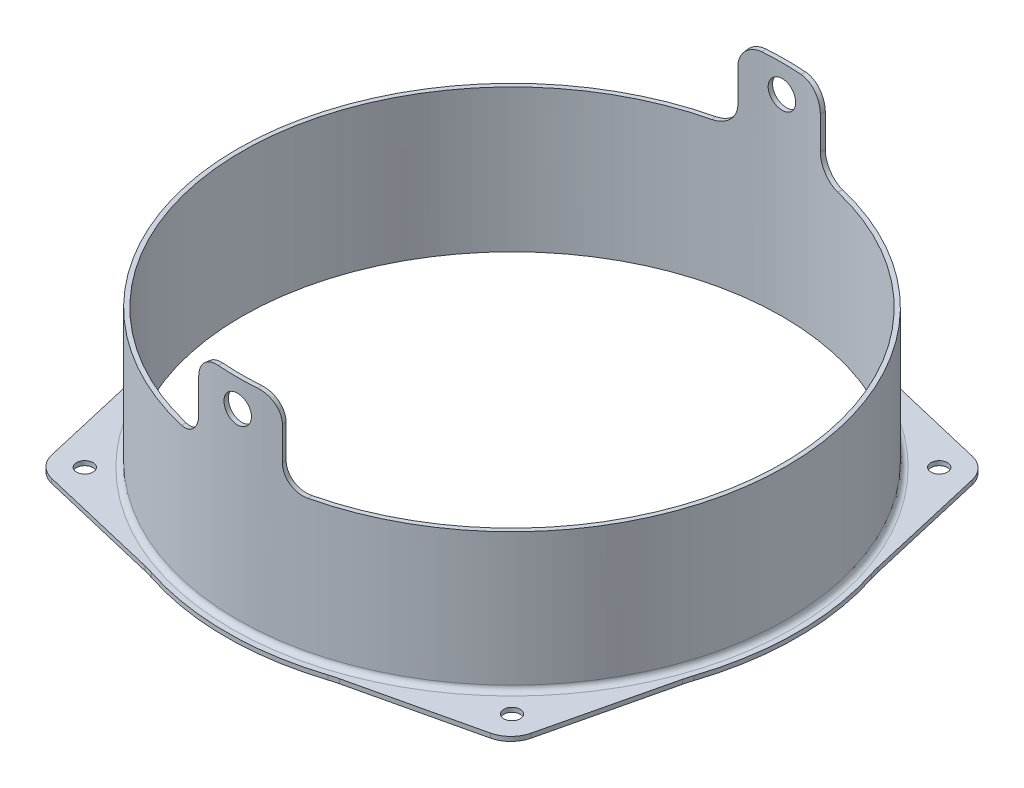
from build123d import *

# Parameters (mm, degrees)
SKETCH1_R               = 50
SKETCH1_R_2             = 1.5
BOSS_EXTRUDE1_DEPTH     = 0.8
SKETCH1_4_R             = 50
SKETCH1_4_R_2           = 49.2
BOSS_EXTRUDE3_DEPTH     = 40
FILLET1_R               = 1
CUT_EXTRUDE1_START      = -14
CUT_EXTRUDE1_DEPTH      = 14
CUT_EXTRUDE2_START      = -14
CUT_EXTRUDE2_DEPTH      = 14
FILLET2_R               = 4
FILLET4_R               = 4
CUT_EXTRUDE3_DEPTH      = 84.713798194
CUT_EXTRUDE3_DEPTH_BACK = 84.713798194
SKETCH16_R              = 2.5


with BuildPart() as part:
    # Sketch1 → Boss-Extrude1 (new body)
    with BuildSketch(Plane(origin=(0, 0, 0), x_dir=(1, 0, 0), z_dir=(0, 1, 0))):
        with BuildLine():
            Line((17.897079586, 48.929734976), (40.149284407, 43.651218265))
            ThreePointArc((40.149284407, 43.651218265), (42.540265174, 42.312242187), (43.866371506, 39.91409958))
            Line((43.866371506, 39.91409958), (49.02521675, 17.633846579))
            ThreePointArc((49.02521675, 17.633846579), (49.23478351, 16.809026698), (49.479249782, 15.993868858))
            ThreePointArc((49.479249782, 15.993868858), (51.999812242, -0.139738387), (49.392575566, -16.259565766))
            ThreePointArc((49.392575566, -16.259565766), (49.143731732, -17.073397941), (48.929734976, -17.897079586))
            Line((48.929734976, -17.897079586), (43.651218265, -40.149284407))
            ThreePointArc((43.651218265, -40.149284407), (42.312242187, -42.540265174), (39.91409958, -43.866371506))
            Line((39.91409958, -43.866371506), (17.633846579, -49.02521675))
            ThreePointArc((17.633846579, -49.02521675), (16.809026698, -49.23478351), (15.993868858, -49.479249782))
            ThreePointArc((15.993868858, -49.479249782), (-0.139738387, -51.999812242), (-16.259565766, -49.392575566))
            ThreePointArc((-16.259565766, -49.392575566), (-17.073397941, -49.143731732), (-17.897079586, -48.929734976))
            Line((-17.897079586, -48.929734976), (-40.149284407, -43.651218265))
            ThreePointArc((-40.149284407, -43.651218265), (-42.540265174, -42.312242187), (-43.866371506, -39.91409958))
            Line((-43.866371506, -39.91409958), (-49.02521675, -17.633846579))
            ThreePointArc((-49.02521675, -17.633846579), (-49.23478351, -16.809026698), (-49.479249782, -15.993868858))
            ThreePointArc((-49.479249782, -15.993868858), (-51.999812242, 0.139738387), (-49.392575566, 16.259565766))
            ThreePointArc((-49.392575566, 16.259565766), (-49.143731732, 17.073397941), (-48.929734976, 17.897079586))
            Line((-48.929734976, 17.897079586), (-43.651218265, 40.149284407))
            ThreePointArc((-43.651218265, 40.149284407), (-42.312242187, 42.540265174), (-39.91409958, 43.866371506))
            Line((-39.91409958, 43.866371506), (-17.633846579, 49.02521675))
            ThreePointArc((-17.633846579, 49.02521675), (-16.809026698, 49.23478351), (-15.993868858, 49.479249782))
            ThreePointArc((-15.993868858, 49.479249782), (-8.026622704, 51.3767781), (0.139738387, 51.999812242))
            ThreePointArc((0.139738387, 51.999812242), (8.302633013, 51.332896714), (16.259565766, 49.392575566))
            ThreePointArc((16.259565766, 49.392575566), (17.073397941, 49.143731732), (17.897079586, 48.929734976))
        make_face()
        Circle(SKETCH1_R, mode=Mode.SUBTRACT)
        with Locations((-38.8907, 38.8907)):
            Circle(SKETCH1_R_2, mode=Mode.SUBTRACT)
        with Locations((38.8907, 38.8907)):
            Circle(SKETCH1_R_2, mode=Mode.SUBTRACT)
        with Locations((38.8907, -38.8907)):
            Circle(SKETCH1_R_2, mode=Mode.SUBTRACT)
        with Locations((-38.8907, -38.8907)):
            Circle(SKETCH1_R_2, mode=Mode.SUBTRACT)
    extrude(amount=BOSS_EXTRUDE1_DEPTH)

    # Sketch1<4> → Boss-Extrude3 (add)
    with BuildSketch(Plane(origin=(0, 0, 0), x_dir=(1, 0, 0), z_dir=(0, 1, 0))):
        Circle(SKETCH1_4_R)
        Circle(SKETCH1_4_R_2, mode=Mode.SUBTRACT)
    extrude(amount=BOSS_EXTRUDE3_DEPTH)

    # Fillet1
    fillet1_edges = [part.edges().sort_by_distance(p)[0] for p in [
        (-50, 0.8, 0),
    ]]
    fillet(fillet1_edges, radius=FILLET1_R)

    # Sketch10 → Cut-Extrude1 (cut)
    with BuildSketch(Plane(origin=(0, 40, 0), x_dir=(1, 0, 0), z_dir=(0, 1, 0)).offset(CUT_EXTRUDE1_START)):
        with BuildLine():
            Line((0, 0), (-7.621909697, 49.41565028))
            ThreePointArc((-7.621909697, 49.41565028), (-50, 0), (-7.621909697, -49.41565028))
            Line((-7.621909697, -49.41565028), (0, 0))
        make_face()
    extrude(amount=CUT_EXTRUDE1_DEPTH, mode=Mode.SUBTRACT)

    # Sketch11 → Cut-Extrude2 (cut)
    with BuildSketch(Plane(origin=(0, 40, 0), x_dir=(1, 0, 0), z_dir=(0, 1, 0)).offset(CUT_EXTRUDE2_START)):
        with BuildLine():
            Line((0, 0), (7.621909697, 49.41565028))
            ThreePointArc((7.621909697, 49.41565028), (50, 0), (7.621909697, -49.41565028))
            Line((7.621909697, -49.41565028), (0, 0))
        make_face()
    extrude(amount=CUT_EXTRUDE2_DEPTH, mode=Mode.SUBTRACT)

    # Fillet2
    fillet2_edges = [part.edges().sort_by_distance(p)[0] for p in [
        (-7.560934419, 26, -49.020325078),
        (7.560934419, 26, -49.020325078),
        (7.560934419, 26, 49.020325078),
        (-7.560934419, 26, 49.020325078),
    ]]
    fillet(fillet2_edges, radius=FILLET2_R)

    # Fillet4
    fillet4_edges = [part.edges().sort_by_distance(p)[0] for p in [
        (7.560934419, 40, -49.020325078),
        (-7.560934419, 40, -49.020325078),
        (7.560934419, 40, 49.020325078),
        (-7.560934419, 40, 49.020325078),
    ]]
    fillet(fillet4_edges, radius=FILLET4_R)

    # Sketch16 → Cut-Extrude3 (cut, two sides: drawn at the far end of the back side and taken through both)
    with BuildSketch(Plane.XY.offset(-CUT_EXTRUDE3_DEPTH_BACK)):
        with Locations((0, 35)):
            Circle(SKETCH16_R)
    extrude(amount=CUT_EXTRUDE3_DEPTH + CUT_EXTRUDE3_DEPTH_BACK, mode=Mode.SUBTRACT)


solid = part.part
